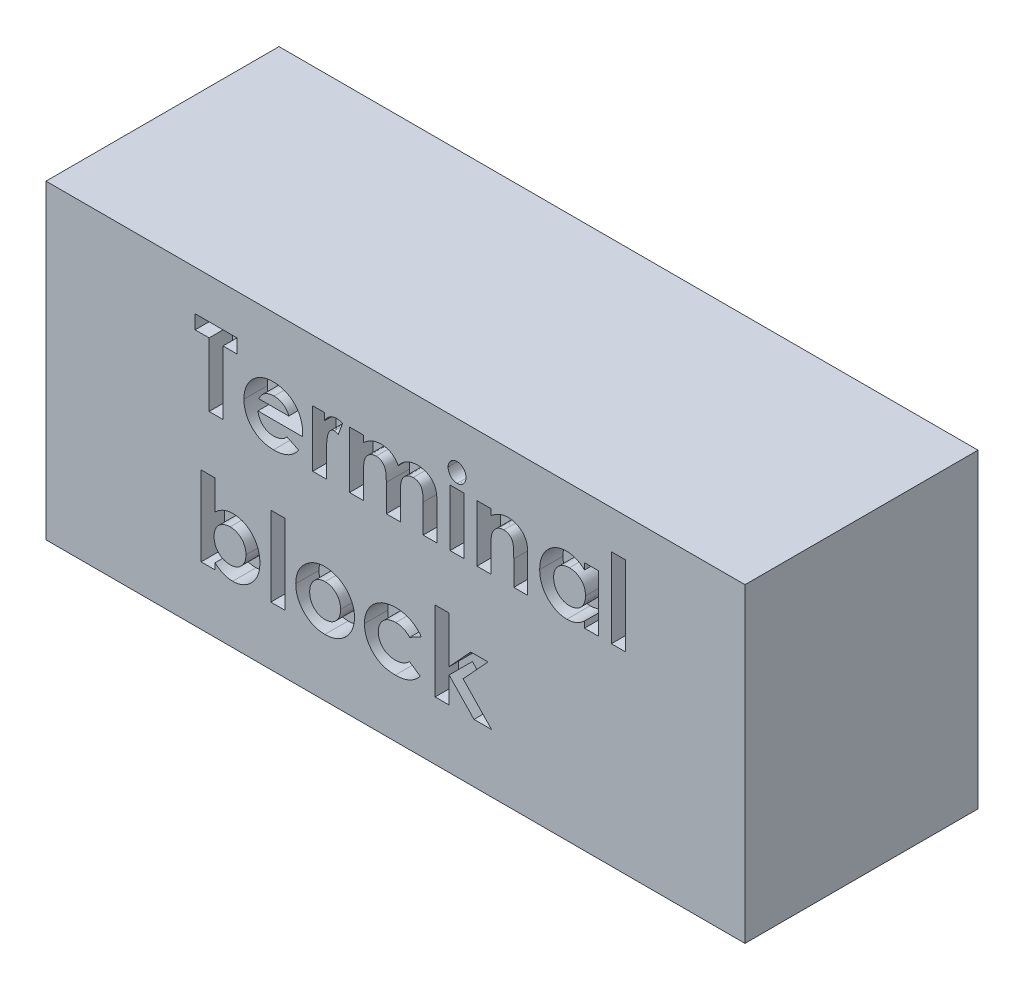
from build123d import *

# Parameters (mm, degrees)
SKETCH_1_W          = 90
SKETCH_1_H          = 40
EXTRUDE_1_DEPTH     = 30
SKETCH_2_W          = 1.794871795
SKETCH_2_H          = 7.307692308
SKETCH_2_H_2        = 10.256410257
CUT_EXTRUDE_1_DEPTH = 3


with BuildPart() as part:
    # ｽｹｯﾁ1 → ﾎﾞｽ - 押し出し1 (new body)
    with BuildSketch(Plane.XY):
        with Locations((45, 20)):
            Rectangle(SKETCH_1_W, SKETCH_1_H)
    extrude(amount=EXTRUDE_1_DEPTH)

    # ｽｹｯﾁ2 → ｶｯﾄ - 押し出し1 (cut)
    # profile 1 of 14: a face of its own
    with BuildSketch(Plane.XY.offset(30)):
        Polygon((19.206870216, 34.815425853), (24.591485601, 34.815425853), (24.591485601, 33.020554058), (22.796613806, 33.020554058), (22.796613806, 24.815425853), (21.001742011, 24.815425853), (21.001742011, 33.020554058), (19.206870216, 33.020554058), align=None)
    # profile 2 of 14: a face of its own
    with BuildSketch(Plane.XY.offset(30)):
        with BuildLine():
            Line((33.047014447, 28.020554058), (27.283793293, 28.020554058))
            add(Edge.make_bspline(
                [(27.283793293, 28.020554058), (27.295544036, 27.953588698), (27.318635172, 27.821996482), (27.368778395, 27.63084737), (27.432768668, 27.450711672), (27.509456981, 27.281348593), (27.597550368, 27.121862776), (27.700304007, 26.973002271), (27.81641456, 26.834898562), (27.945210707, 26.708151863), (28.08454565, 26.594584073), (28.233743666, 26.495091511), (28.392958719, 26.413513695), (28.560365467, 26.344752062), (28.737214825, 26.290285883), (28.923767069, 26.252721595), (29.119527679, 26.230532232), (29.252885787, 26.227322794), (29.321052909, 26.225682263)],
                knots=[0, 0, 0, 0, 1.091296461, 2.144483647, 3.168565212, 4.157007626, 5.126487748, 6.090021542, 7.05641414, 8.019231907, 8.98705074, 9.938580405, 10.892824166, 11.854447369, 12.841318655, 13.858982407, 14.905600794, 16, 16, 16, 16], degree=3))
            add(Edge.make_bspline(
                [(29.321052909, 26.225682263), (29.403335252, 26.227854597), (29.565373418, 26.232132561), (29.802760538, 26.270071749), (30.032348463, 26.327377225), (30.251964482, 26.412595277), (30.464152501, 26.518676773), (30.665419254, 26.650841262), (30.859248512, 26.805226469), (30.977507201, 26.924226528), (31.037799703, 26.984897007)],
                knots=[0, 0, 0, 0, 1.021034703, 2.010718019, 2.977989445, 3.954245119, 4.929443971, 5.918328161, 6.938689359, 8, 8, 8, 8], degree=3))
            Line((31.037799703, 26.984897007), (32.54020355, 26.269752776))
            add(Edge.make_bspline(
                [(32.54020355, 26.269752776), (32.492901241, 26.204388246), (32.399173457, 26.074870833), (32.246165995, 25.892606383), (32.086492965, 25.722546257), (31.920035283, 25.565808966), (31.746581841, 25.42284115), (31.566615142, 25.291901203), (31.377505048, 25.176504809), (31.183032781, 25.07106916), (30.979178238, 24.980679668), (30.766505576, 24.903598699), (30.545915582, 24.833918159), (30.314622683, 24.780825405), (30.07455285, 24.738797614), (29.825131791, 24.708952315), (29.566392378, 24.690518303), (29.390528707, 24.688332974), (29.301020857, 24.687220725)],
                knots=[0, 0, 0, 0, 1.028154879, 2.037251081, 3.030720504, 4.000128189, 4.949298328, 5.894184978, 6.834267904, 7.770992897, 8.712077017, 9.673380525, 10.653304757, 11.658697181, 12.695551717, 13.758623199, 14.859225354, 16, 16, 16, 16], degree=3))
            add(Edge.make_bspline(
                [(29.301020857, 24.687220725), (29.1633145, 24.690028143), (28.893624537, 24.69552631), (28.499154213, 24.746557169), (28.124516816, 24.831171832), (27.7686545, 24.946192472), (27.43310554, 25.09805575), (27.11770387, 25.283797136), (26.819298178, 25.499855597), (26.547006424, 25.750765624), (26.298940602, 26.023866272), (26.081055007, 26.317157719), (25.898731445, 26.628590847), (25.749003668, 26.956104529), (25.632630039, 27.30053707), (25.548731403, 27.662038774), (25.497300533, 28.04043698), (25.491745744, 28.298168399), (25.488921498, 28.429207904)],
                knots=[0, 0, 0, 0, 1.103565453, 2.161269334, 3.182010356, 4.179077853, 5.15417608, 6.128274628, 7.109042802, 8.101804412, 9.090965879, 10.063106201, 11.02526161, 11.978650795, 12.945248442, 13.93468508, 14.949922959, 16, 16, 16, 16], degree=3))
            add(Edge.make_bspline(
                [(25.488921498, 28.429207904), (25.49177354, 28.563577292), (25.497384805, 28.827943027), (25.548288583, 29.215078621), (25.63286199, 29.584458341), (25.749576038, 29.93659086), (25.897032425, 30.272577498), (26.081675742, 30.589478776), (26.298832477, 30.88839797), (26.546004647, 31.167936707), (26.819449913, 31.420250957), (27.110011343, 31.645113377), (27.420953693, 31.832483671), (27.748759935, 31.983878752), (28.091333304, 32.106883434), (28.452633469, 32.188732777), (28.829911485, 32.243689712), (29.08781043, 32.248750902), (29.218889447, 32.251323289)],
                knots=[0, 0, 0, 0, 1.079208495, 2.12329425, 3.130605359, 4.119693003, 5.099659317, 6.073216462, 7.060498243, 8.06384408, 9.066070512, 10.045757761, 11.010926815, 11.975797609, 12.942977511, 13.929384301, 14.947594487, 16, 16, 16, 16], degree=3))
            add(Edge.make_bspline(
                [(29.218889447, 32.251323289), (29.357255511, 32.248472316), (29.628923017, 32.242874723), (30.026140705, 32.192258224), (30.40326565, 32.10712759), (30.761904614, 31.993101513), (31.097477631, 31.837402009), (31.417358258, 31.656231424), (31.713873943, 31.435502695), (31.990185228, 31.185820541), (32.239612634, 30.908806844), (32.457639823, 30.607885125), (32.643154127, 30.285992205), (32.793515311, 29.941822738), (32.909769446, 29.576409956), (32.993745746, 29.190228418), (33.04478432, 28.781809275), (33.050235748, 28.50214128), (33.053024062, 28.359095725)],
                knots=[0, 0, 0, 0, 1.080001299, 2.120471247, 3.119684163, 4.095710327, 5.052285597, 6.002875087, 6.961153713, 7.931888285, 8.906493152, 9.865905668, 10.82813294, 11.801621613, 12.7925306, 13.817193356, 14.883530496, 16, 16, 16, 16], degree=3))
            Line((33.053024062, 28.359095725), (33.047014447, 28.020554058))
        make_face()
        with BuildLine():
            add(Edge.make_bspline(
                [(31.258152267, 29.430810469), (31.224281939, 29.522212765), (31.156938903, 29.703944341), (31.004813786, 29.954689573), (30.802948624, 30.171845127), (30.568164958, 30.364094661), (30.299909919, 30.520136392), (30.006636693, 30.633115673), (29.692052196, 30.700859467), (29.475635014, 30.708804624), (29.365123421, 30.712861751)],
                knots=[0, 0, 0, 0, 0.954238005, 1.897273737, 2.851915805, 3.847685534, 4.862635127, 5.880135777, 6.917509367, 8, 8, 8, 8], degree=3))
            add(Edge.make_bspline(
                [(29.365123421, 30.712861751), (29.244426769, 30.708964386), (29.008489945, 30.701345851), (28.66816714, 30.620319928), (28.347149154, 30.499391158), (28.157895143, 30.374711029), (28.063040088, 30.312220725)],
                knots=[0, 0, 0, 0, 1.044195649, 2.041185066, 3.018232172, 4, 4, 4, 4], degree=3))
            add(Edge.make_bspline(
                [(28.063040088, 30.312220725), (28.003857618, 30.264626741), (27.877683617, 30.1631588), (27.713821079, 29.960739892), (27.552415115, 29.715656033), (27.460646925, 29.529497528), (27.411998421, 29.430810469)],
                knots=[0, 0, 0, 0, 0.82159062, 1.751589201, 2.808063854, 4, 4, 4, 4], degree=3))
            Line((27.411998421, 29.430810469), (31.258152267, 29.430810469))
        make_face(mode=Mode.SUBTRACT)
    # profile 3 of 14: a face of its own
    with BuildSketch(Plane.XY.offset(30)):
        with BuildLine():
            Line((34.335075344, 32.123118161), (35.873536883, 32.123118161))
            Line((35.873536883, 32.123118161), (35.873536883, 31.223679058))
            add(Edge.make_bspline(
                [(35.873536883, 31.223679058), (35.917057006, 31.303612459), (36.002118893, 31.459845606), (36.158384713, 31.669557667), (36.337909217, 31.846171314), (36.534241533, 31.993380582), (36.747976706, 32.108115752), (36.97339129, 32.189879024), (37.208556866, 32.243013822), (37.36897885, 32.248533522), (37.450059319, 32.251323289)],
                knots=[0, 0, 0, 0, 1.09866127, 2.147379032, 3.14564304, 4.131443017, 5.102343063, 6.064490016, 7.021754664, 8, 8, 8, 8], degree=3))
            add(Edge.make_bspline(
                [(37.450059319, 32.251323289), (37.508933857, 32.248566417), (37.628823438, 32.24295244), (37.811552032, 32.210318308), (37.996917078, 32.151309593), (38.118903251, 32.098180087), (38.181229191, 32.071034828)],
                knots=[0, 0, 0, 0, 0.931404136, 1.896671404, 2.925354185, 4, 4, 4, 4], degree=3))
            Line((38.181229191, 32.071034828), (37.624338165, 30.550602135))
            add(Edge.make_bspline(
                [(37.624338165, 30.550602135), (37.57456006, 30.574652509), (37.480996384, 30.619857953), (37.345158173, 30.673205035), (37.221879364, 30.705754817), (37.143722862, 30.710611529), (37.107511242, 30.712861751)],
                knots=[0, 0, 0, 0, 1.214386998, 2.282580073, 3.20428172, 4, 4, 4, 4], degree=3))
            add(Edge.make_bspline(
                [(37.107511242, 30.712861751), (37.073320431, 30.711370635), (37.006061214, 30.708437354), (36.906788493, 30.68330013), (36.813294262, 30.639951765), (36.721073039, 30.584418209), (36.637400056, 30.507222412), (36.553778756, 30.417854571), (36.480087189, 30.307518083), (36.402321215, 30.18470797), (36.336106269, 30.034388501), (36.279328991, 29.854938033), (36.228739981, 29.644280199), (36.193927835, 29.401296511), (36.160280498, 29.128338254), (36.140252777, 28.82340195), (36.125325863, 28.487451835), (36.124413182, 28.25294653), (36.123937524, 28.13073034)],
                knots=[0, 0, 0, 0, 0.544232178, 1.070598461, 1.618251235, 2.182094276, 2.777567932, 3.425210017, 4.127676488, 4.886675562, 5.738955394, 6.734782583, 7.883056018, 9.186093582, 10.642914445, 12.264202625, 14.053029461, 16, 16, 16, 16], degree=3))
            Line((36.123937524, 28.13073034), (36.129947139, 27.774159828))
            Line((36.129947139, 27.774159828), (36.129947139, 24.815425853))
            Line((36.129947139, 24.815425853), (34.335075344, 24.815425853))
            Line((34.335075344, 24.815425853), (34.335075344, 32.123118161))
        make_face()
    # profile 4 of 14: a face of its own
    with BuildSketch(Plane.XY.offset(30)):
        with BuildLine():
            Line((39.078665088, 32.123118161), (40.873536883, 32.123118161))
            Line((40.873536883, 32.123118161), (40.873536883, 31.249720725))
            add(Edge.make_bspline(
                [(40.873536883, 31.249720725), (40.953371868, 31.330297168), (41.110560393, 31.488945561), (41.371052528, 31.692902333), (41.642772201, 31.86731057), (41.929012224, 32.008505015), (42.229072467, 32.116317171), (42.5415308, 32.195320329), (42.867992138, 32.241929718), (43.090268186, 32.24815739), (43.203264447, 32.251323289)],
                knots=[0, 0, 0, 0, 1.041528618, 2.050684245, 3.032913108, 4.004406485, 4.976926473, 5.95771665, 6.961784757, 8, 8, 8, 8], degree=3))
            add(Edge.make_bspline(
                [(43.203264447, 32.251323289), (43.316409902, 32.247764361), (43.539133071, 32.240758725), (43.864084625, 32.176650595), (44.171924303, 32.072496546), (44.459265147, 31.924037747), (44.728183888, 31.740698847), (44.966767248, 31.513007981), (45.181520943, 31.250029028), (45.295992929, 31.051214113), (45.354706755, 30.949239956)],
                knots=[0, 0, 0, 0, 1.023965777, 2.015643508, 2.987309376, 3.958410333, 4.93654923, 5.924956801, 6.93568961, 8, 8, 8, 8], degree=3))
            add(Edge.make_bspline(
                [(45.354706755, 30.949239956), (45.430337749, 31.051491521), (45.578780168, 31.25218265), (45.841907875, 31.514207673), (46.126427431, 31.74072259), (46.437843635, 31.925391284), (46.76788635, 32.071989807), (47.115111353, 32.176263606), (47.476370584, 32.240651583), (47.722227316, 32.247736502), (47.846693934, 32.251323289)],
                knots=[0, 0, 0, 0, 1.041189987, 2.043563759, 3.033412161, 4.015238574, 5.00275396, 5.986226558, 6.980513695, 8, 8, 8, 8], degree=3))
            add(Edge.make_bspline(
                [(47.846693934, 32.251323289), (47.975253171, 32.247598963), (48.225610333, 32.240346185), (48.588413811, 32.168991543), (48.928223172, 32.058737914), (49.237528723, 31.898291901), (49.517212633, 31.708237243), (49.755537064, 31.483679735), (49.953324566, 31.232455146), (50.082109593, 30.997872679), (50.165365653, 30.790474915), (50.215636401, 30.61), (50.262655105, 30.408476931), (50.296433338, 30.183196955), (50.327963829, 29.936277529), (50.346268518, 29.666077051), (50.358710406, 29.373505761), (50.360031891, 29.171077279), (50.36071637, 29.066227135)],
                knots=[0, 0, 0, 0, 1.321991808, 2.574456155, 3.791773975, 4.987670122, 6.148905103, 7.262530793, 8.344737981, 9.427709016, 10.004683293, 10.642050061, 11.354108788, 12.133887687, 12.985666279, 13.916212488, 14.92067847, 16, 16, 16, 16], degree=3))
            Line((50.36071637, 29.066227135), (50.36071637, 24.815425853))
            Line((50.36071637, 24.815425853), (48.565844575, 24.815425853))
            Line((48.565844575, 24.815425853), (48.565844575, 28.485297648))
            add(Edge.make_bspline(
                [(48.565844575, 28.485297648), (48.564350684, 28.583459897), (48.561483296, 28.771873463), (48.549292923, 29.042116753), (48.522005654, 29.287204095), (48.490021478, 29.508493046), (48.444251505, 29.704810305), (48.388443334, 29.87662912), (48.323706195, 30.024196818), (48.24553805, 30.147498019), (48.157989636, 30.251337107), (48.060604656, 30.340347769), (47.954398496, 30.416291477), (47.838408241, 30.481022696), (47.709595244, 30.524801701), (47.572308029, 30.55915227), (47.425472282, 30.582545254), (47.323950079, 30.583939875), (47.271774062, 30.584656622)],
                knots=[0, 0, 0, 0, 1.669139205, 3.203761885, 4.596586177, 5.860166715, 7.002923539, 8.018877315, 8.928339525, 9.734594377, 10.491888885, 11.231098709, 11.971440889, 12.708030942, 13.480072485, 14.275788656, 15.113863979, 16, 16, 16, 16], degree=3))
            add(Edge.make_bspline(
                [(47.271774062, 30.584656622), (47.191371559, 30.5818769), (47.033597645, 30.576422246), (46.803688897, 30.524296928), (46.587343071, 30.439077611), (46.385370687, 30.323144278), (46.202117743, 30.178345735), (46.041817805, 30.006600858), (45.909432412, 29.806919864), (45.817792016, 29.621655956), (45.76052828, 29.454140156), (45.720133918, 29.310676327), (45.688648119, 29.148439956), (45.664003957, 28.969074123), (45.640360761, 28.771564855), (45.628761542, 28.556161909), (45.616892001, 28.323164532), (45.617046518, 28.162133369), (45.617126626, 28.078647007)],
                knots=[0, 0, 0, 0, 1.129913425, 2.217230253, 3.297175357, 4.391411011, 5.481605898, 6.571841268, 7.681894157, 8.841607612, 9.468549532, 10.170608623, 10.93710061, 11.791434153, 12.717934886, 13.734733707, 14.825576123, 16, 16, 16, 16], degree=3))
            Line((45.617126626, 28.078647007), (45.617126626, 24.815425853))
            Line((45.617126626, 24.815425853), (43.822254832, 24.815425853))
            Line((43.822254832, 24.815425853), (43.822254832, 28.319031622))
            add(Edge.make_bspline(
                [(43.822254832, 28.319031622), (43.822104134, 28.397166644), (43.82181424, 28.547473116), (43.813100604, 28.764518539), (43.801562047, 28.964930222), (43.785386334, 29.149267149), (43.766730834, 29.31730005), (43.739806649, 29.468109669), (43.711520309, 29.602527012), (43.663022995, 29.755221103), (43.594684045, 29.924431709), (43.492584654, 30.103870135), (43.369132545, 30.254107529), (43.227447964, 30.376313057), (43.067338308, 30.469423863), (42.892859652, 30.538686731), (42.700680436, 30.576072701), (42.568397113, 30.581734933), (42.500139447, 30.584656622)],
                knots=[0, 0, 0, 0, 1.256487322, 2.417074606, 3.49288742, 4.484586665, 5.393016842, 6.210437544, 6.947749329, 7.599905853, 8.784490193, 9.876739139, 10.906602197, 11.896672079, 12.869113195, 13.872201355, 14.902064413, 16, 16, 16, 16], degree=3))
            add(Edge.make_bspline(
                [(42.500139447, 30.584656622), (42.423014158, 30.582038856), (42.270266879, 30.576854349), (42.047767132, 30.521168501), (41.835036739, 30.437512798), (41.636755553, 30.31834591), (41.456263326, 30.170139816), (41.297568332, 29.9935098), (41.165878675, 29.788665374), (41.073831504, 29.598291223), (41.017402741, 29.426596136), (40.975922234, 29.279407133), (40.945607906, 29.113597952), (40.920315283, 28.931030336), (40.896812063, 28.731488785), (40.88516485, 28.514095792), (40.873307037, 28.279092319), (40.873458421, 28.116727006), (40.873536883, 28.032573289)],
                knots=[0, 0, 0, 0, 1.07893236, 2.136834559, 3.195274846, 4.273923004, 5.364443877, 6.458052972, 7.587287137, 8.767908, 9.410170275, 10.118584836, 10.909717261, 11.770069756, 12.702352573, 13.724628867, 14.820678298, 16, 16, 16, 16], degree=3))
            Line((40.873536883, 28.032573289), (40.873536883, 24.815425853))
            Line((40.873536883, 24.815425853), (39.078665088, 24.815425853))
            Line((39.078665088, 24.815425853), (39.078665088, 32.123118161))
        make_face()
    # profile 5 of 14: a face of its own
    with BuildSketch(Plane.XY.offset(30)):
        with BuildLine():
            add(Edge.make_bspline(
                [(52.920812524, 35.200041238), (52.998171486, 35.196245714), (53.15007326, 35.188792838), (53.367693223, 35.116143876), (53.567424245, 35.002123502), (53.743992007, 34.845684829), (53.890844561, 34.658868442), (54.003045367, 34.449715075), (54.065547761, 34.217979881), (54.074228419, 34.057899633), (54.078665088, 33.976082904)],
                knots=[0, 0, 0, 0, 0.989868614, 1.943702388, 2.910836514, 3.924849579, 4.949916355, 5.946401046, 6.950409252, 8, 8, 8, 8], degree=3))
            add(Edge.make_bspline(
                [(54.078665088, 33.976082904), (54.074387156, 33.89486912), (54.066051401, 33.736620195), (54.001606836, 33.508030914), (53.893909381, 33.298979133), (53.745867413, 33.114937316), (53.571213876, 32.961018181), (53.37584713, 32.844927835), (53.160312597, 32.776320318), (53.010767879, 32.768244423), (52.93483496, 32.764143802)],
                knots=[0, 0, 0, 0, 1.05296456, 2.051751585, 3.055639087, 4.085634717, 5.099016424, 6.062201612, 7.016062274, 8, 8, 8, 8], degree=3))
            add(Edge.make_bspline(
                [(52.93483496, 32.764143802), (52.856800719, 32.767925757), (52.703577405, 32.775351775), (52.48417251, 32.848170719), (52.281777587, 32.96129311), (52.105975774, 33.120928066), (51.95744143, 33.309071926), (51.850141601, 33.523094564), (51.783022903, 33.756414358), (51.775055972, 33.918865503), (51.77097278, 34.002124571)],
                knots=[0, 0, 0, 0, 0.989065327, 1.942068821, 2.907541208, 3.917690034, 4.939857478, 5.938239964, 6.943311734, 8, 8, 8, 8], degree=3))
            add(Edge.make_bspline(
                [(51.77097278, 34.002124571), (51.775416409, 34.081959297), (51.784145277, 34.23878309), (51.847022068, 34.465366131), (51.956650113, 34.671003303), (52.102444873, 34.854399842), (52.277461777, 35.007920344), (52.477072897, 35.118477846), (52.69322827, 35.188126199), (52.844167801, 35.196028549), (52.920812524, 35.200041238)],
                knots=[0, 0, 0, 0, 1.038616768, 2.040212704, 3.031499824, 4.052181184, 5.074969369, 6.039807101, 7.004644834, 8, 8, 8, 8], degree=3))
        make_face()
    # profile 6 of 14: a face of its own
    with BuildSketch(Plane.XY.offset(30)):
        with Locations((52.924818935, 28.469272007)):
            Rectangle(SKETCH_2_W, SKETCH_2_H)
    # profile 7 of 14: a face of its own
    with BuildSketch(Plane.XY.offset(30)):
        with BuildLine():
            Line((55.488921498, 32.123118161), (57.283793293, 32.123118161))
            Line((57.283793293, 32.123118161), (57.283793293, 31.349880981))
            add(Edge.make_bspline(
                [(57.283793293, 31.349880981), (57.386189839, 31.429527124), (57.581889545, 31.581746385), (57.879386885, 31.775826719), (58.160187542, 31.934673679), (58.430550861, 32.055500805), (58.695563737, 32.142430727), (58.959518243, 32.20488469), (59.226345197, 32.244875679), (59.405717677, 32.249175239), (59.495331755, 32.251323289)],
                knots=[0, 0, 0, 0, 1.276643801, 2.439914479, 3.493451431, 4.44993799, 5.350072675, 6.235028322, 7.118224225, 8, 8, 8, 8], degree=3))
            add(Edge.make_bspline(
                [(59.495331755, 32.251323289), (59.586233177, 32.248868512), (59.764680303, 32.24404958), (60.027433863, 32.21034505), (60.278469371, 32.148958424), (60.520609517, 32.067453588), (60.751389727, 31.959871878), (60.9736372, 31.832136053), (61.182578137, 31.676545176), (61.311253217, 31.558054634), (61.37634137, 31.498118161)],
                knots=[0, 0, 0, 0, 1.048836932, 2.058954983, 3.049370783, 4.026390553, 5.001981509, 5.982488534, 6.97947532, 8, 8, 8, 8], degree=3))
            add(Edge.make_bspline(
                [(61.37634137, 31.498118161), (61.428544465, 31.442574577), (61.533332718, 31.331080895), (61.665195569, 31.14028665), (61.778348728, 30.932286001), (61.871062018, 30.704679592), (61.939573405, 30.456216874), (61.992280149, 30.189898922), (62.021854823, 29.904234551), (62.025505955, 29.707985824), (62.027383037, 29.60709252)],
                knots=[0, 0, 0, 0, 0.889584746, 1.785680191, 2.700364693, 3.65222533, 4.649950538, 5.707241244, 6.821271309, 8, 8, 8, 8], degree=3))
            Line((62.027383037, 29.60709252), (62.027383037, 24.815425853))
            Line((62.027383037, 24.815425853), (60.232511242, 24.815425853))
            Line((60.232511242, 24.815425853), (60.232511242, 27.988502776))
            add(Edge.make_bspline(
                [(60.232511242, 27.988502776), (60.232131666, 28.092003018), (60.23140428, 28.29034202), (60.225819561, 28.57419494), (60.214914937, 28.830550988), (60.204975656, 29.059876916), (60.185460896, 29.261358462), (60.167862171, 29.436271158), (60.140858633, 29.583028182), (60.105722649, 29.740887382), (60.044366567, 29.909904523), (59.949114242, 30.087992004), (59.82827331, 30.239281289), (59.686779398, 30.364832992), (59.524788773, 30.464155904), (59.344258858, 30.53403576), (59.146157508, 30.577586602), (59.008122815, 30.582239988), (58.936437524, 30.584656622)],
                knots=[0, 0, 0, 0, 1.49886392, 2.872294502, 4.110984203, 5.214877267, 6.195405875, 7.042225351, 7.75923308, 8.355011229, 9.382752534, 10.352059385, 11.267231453, 12.171456522, 13.078624015, 14.003401117, 14.963110155, 16, 16, 16, 16], degree=3))
            add(Edge.make_bspline(
                [(58.936437524, 30.584656622), (58.843207788, 30.579928918), (58.660832301, 30.570680608), (58.397062643, 30.500939915), (58.154794608, 30.382331525), (57.936007723, 30.218201363), (57.742785752, 30.015562341), (57.58364301, 29.773892061), (57.453113268, 29.499023222), (57.396983539, 29.298324322), (57.367927909, 29.194432263)],
                knots=[0, 0, 0, 0, 0.984188326, 1.925263693, 2.85911992, 3.81709677, 4.80007086, 5.801799564, 6.862098548, 8, 8, 8, 8], degree=3))
            add(Edge.make_bspline(
                [(57.367927909, 29.194432263), (57.36070643, 29.161804266), (57.344601081, 29.089037272), (57.331356469, 28.96610539), (57.312932252, 28.820258614), (57.30602915, 28.648857527), (57.294025417, 28.452713301), (57.289585863, 28.231566441), (57.285138365, 27.985850579), (57.284256504, 27.814227385), (57.283793293, 27.724079699)],
                knots=[0, 0, 0, 0, 0.543362196, 1.211806945, 2.009705693, 2.934833164, 4.000995085, 5.207458376, 6.533175157, 8, 8, 8, 8], degree=3))
            Line((57.283793293, 27.724079699), (57.283793293, 24.815425853))
            Line((57.283793293, 24.815425853), (55.488921498, 24.815425853))
            Line((55.488921498, 24.815425853), (55.488921498, 32.123118161))
        make_face()
    # profile 8 of 14: a face of its own
    with BuildSketch(Plane.XY.offset(30)):
        with BuildLine():
            Line((69.335075344, 32.123118161), (71.129947139, 32.123118161))
            Line((71.129947139, 32.123118161), (71.129947139, 24.815425853))
            Line((71.129947139, 24.815425853), (69.335075344, 24.815425853))
            Line((69.335075344, 24.815425853), (69.335075344, 25.612701494))
            add(Edge.make_bspline(
                [(69.335075344, 25.612701494), (69.246140108, 25.535095535), (69.073534378, 25.384477693), (68.801563599, 25.189047213), (68.52879809, 25.027842325), (68.253927205, 24.899451423), (67.972726294, 24.804647957), (67.683170823, 24.736008032), (67.381090885, 24.69552939), (67.175741105, 24.690019129), (67.07145355, 24.687220725)],
                knots=[0, 0, 0, 0, 1.129196829, 2.191548051, 3.199897424, 4.157751732, 5.089409408, 6.034969131, 7.002052659, 8, 8, 8, 8], degree=3))
            add(Edge.make_bspline(
                [(67.07145355, 24.687220725), (66.954386132, 24.689854376), (66.72305428, 24.695058619), (66.38360047, 24.749841675), (66.055824068, 24.833699352), (65.739991139, 24.952368446), (65.436676312, 25.106140329), (65.143558307, 25.291002875), (64.865662062, 25.513445867), (64.600674185, 25.763844763), (64.358052875, 26.039285331), (64.145951034, 26.335944492), (63.967164946, 26.649614791), (63.820695071, 26.979256268), (63.7054776, 27.324626984), (63.62334403, 27.68682235), (63.574885129, 28.065971724), (63.568887282, 28.324233428), (63.565844575, 28.455249571)],
                knots=[0, 0, 0, 0, 0.980476535, 1.937477201, 2.874147792, 3.812856188, 4.758993464, 5.720109578, 6.712210464, 7.737600662, 8.772720504, 9.783789959, 10.789002326, 11.793715968, 12.802552247, 13.835794126, 14.902098527, 16, 16, 16, 16], degree=3))
            add(Edge.make_bspline(
                [(63.565844575, 28.455249571), (63.569037908, 28.590916959), (63.575301985, 28.857043658), (63.621123337, 29.247571935), (63.701741234, 29.618747905), (63.811669531, 29.9710857), (63.953073197, 30.304646193), (64.125293415, 30.61997586), (64.330673078, 30.916250481), (64.567336732, 31.188427253), (64.82287535, 31.437890412), (65.096256497, 31.655067874), (65.383205088, 31.839570234), (65.684026058, 31.990195759), (65.998676446, 32.106591542), (66.325914018, 32.191686364), (66.667191479, 32.242746245), (66.899672452, 32.248440531), (67.017367011, 32.251323289)],
                knots=[0, 0, 0, 0, 1.136281865, 2.228943489, 3.287578264, 4.313574083, 5.316051562, 6.317280042, 7.318008486, 8.329309503, 9.333984563, 10.305318864, 11.248632312, 12.186624717, 13.117503092, 14.05354244, 15.014596925, 16, 16, 16, 16], degree=3))
            add(Edge.make_bspline(
                [(67.017367011, 32.251323289), (67.126390309, 32.249058307), (67.342108117, 32.244576725), (67.659182214, 32.195915314), (67.966698356, 32.122318386), (68.262979029, 32.017456012), (68.550454423, 31.88504593), (68.824179782, 31.719126229), (69.090143093, 31.526670438), (69.252422531, 31.376358389), (69.335075344, 31.299800853)],
                knots=[0, 0, 0, 0, 1.017011718, 2.012299608, 2.98747302, 3.965332399, 4.941441765, 5.936729654, 6.94912688, 8, 8, 8, 8], degree=3))
            Line((69.335075344, 31.299800853), (69.335075344, 32.123118161))
        make_face()
        with BuildLine():
            add(Edge.make_bspline(
                [(67.393969575, 30.584656622), (67.322449225, 30.582462131), (67.182274009, 30.578161072), (66.97612717, 30.552289899), (66.779112634, 30.506703739), (66.592635492, 30.439359978), (66.413916551, 30.357325465), (66.245669684, 30.254578587), (66.0865063, 30.133133961), (65.937362456, 29.995931759), (65.801395867, 29.845121453), (65.684184732, 29.680554735), (65.584574203, 29.506665742), (65.500329584, 29.322931649), (65.44002955, 29.127178315), (65.392271949, 28.921954099), (65.367488845, 28.705582426), (65.36299645, 28.558131827), (65.36071637, 28.483294443)],
                knots=[0, 0, 0, 0, 1.04836806, 2.054732945, 3.03993516, 4.00574415, 4.955904794, 5.917688631, 6.888591924, 7.88601754, 8.884115178, 9.859153345, 10.841239365, 11.818093293, 12.814750328, 13.83810466, 14.90274714, 16, 16, 16, 16], degree=3))
            add(Edge.make_bspline(
                [(65.36071637, 28.483294443), (65.362961621, 28.407778241), (65.367385862, 28.25897444), (65.392672667, 28.040777593), (65.438711753, 27.832555534), (65.505881044, 27.635991596), (65.587910328, 27.448433481), (65.687758414, 27.270746786), (65.8104043, 27.106073237), (65.946490078, 26.950516103), (66.098693585, 26.811609619), (66.25875758, 26.688273415), (66.428868409, 26.585078091), (66.607180492, 26.501674978), (66.793093622, 26.433708452), (66.988938584, 26.388695217), (67.192796832, 26.359919108), (67.331772383, 26.355911847), (67.401982396, 26.353887392)],
                knots=[0, 0, 0, 0, 1.099136573, 2.165835871, 3.191374663, 4.196217796, 5.183857741, 6.167377911, 7.154730987, 8.166690795, 9.170734848, 10.148332609, 11.103258353, 12.059567475, 13.009337315, 13.978056681, 14.978520572, 16, 16, 16, 16], degree=3))
            add(Edge.make_bspline(
                [(67.401982396, 26.353887392), (67.474834896, 26.356094186), (67.6176654, 26.360420702), (67.82717542, 26.386055772), (68.026836568, 26.431809077), (68.215818147, 26.499538397), (68.39700667, 26.580984065), (68.568767074, 26.68172319), (68.729235499, 26.802889134), (68.879224645, 26.941331648), (69.016660783, 27.09337341), (69.135492855, 27.26009816), (69.238999938, 27.436173581), (69.320403496, 27.62576274), (69.385049337, 27.82554871), (69.431431237, 28.036771406), (69.456660301, 28.259658552), (69.461045848, 28.411787715), (69.463280473, 28.489304058)],
                knots=[0, 0, 0, 0, 1.050008698, 2.058587853, 3.036635738, 3.995319155, 4.947022481, 5.895997462, 6.858296291, 7.838991643, 8.833936038, 9.806048392, 10.784806122, 11.771666913, 12.772873988, 13.80724452, 14.882696879, 16, 16, 16, 16], degree=3))
            add(Edge.make_bspline(
                [(69.463280473, 28.489304058), (69.461073616, 28.565487158), (69.456762982, 28.714294882), (69.431322431, 28.932528249), (69.384611246, 29.139603496), (69.321295923, 29.335901254), (69.238444171, 29.52097269), (69.134858771, 29.692765803), (69.017330219, 29.857232582), (68.878372464, 30.005166854), (68.729195843, 30.142606938), (68.56636747, 30.260108735), (68.395017321, 30.361375045), (68.214092618, 30.444518591), (68.02191808, 30.505465962), (67.821915725, 30.552655282), (67.610965099, 30.578145544), (67.46748179, 30.582450845), (67.393969575, 30.584656622)],
                knots=[0, 0, 0, 0, 1.106611376, 2.161533483, 3.185006901, 4.184773755, 5.152708835, 6.122342771, 7.094156588, 8.082475533, 9.064254463, 10.03606828, 10.992420271, 11.951521816, 12.920622147, 13.915721683, 14.932141191, 16, 16, 16, 16], degree=3))
        make_face(mode=Mode.SUBTRACT)
    # profile 9 of 14: a face of its own
    with BuildSketch(Plane.XY.offset(30)):
        with Locations((73.694049704, 29.943630982)):
            Rectangle(SKETCH_2_W, SKETCH_2_H_2)
    # profile 10 of 14: a face of its own
    with BuildSketch(Plane.XY.offset(30)):
        with BuildLine():
            Line((21.77097278, 17.789784828), (21.77097278, 13.989704699))
            add(Edge.make_bspline(
                [(21.77097278, 13.989704699), (21.854318418, 14.06817964), (22.017930342, 14.222230128), (22.285062691, 14.421434269), (22.561779988, 14.589560932), (22.847834335, 14.730611337), (23.145800246, 14.83491203), (23.452016672, 14.915957575), (23.769621325, 14.958881005), (23.98440393, 14.965789207), (24.092687524, 14.969272007)],
                knots=[0, 0, 0, 0, 1.061187343, 2.083167259, 3.083809127, 4.061667593, 5.035358583, 6.007314429, 6.995378812, 8, 8, 8, 8], degree=3))
            add(Edge.make_bspline(
                [(24.092687524, 14.969272007), (24.210393259, 14.966452658), (24.442235363, 14.960899455), (24.783346907, 14.909052329), (25.11024073, 14.825245016), (25.424163363, 14.708227166), (25.723442261, 14.556299031), (26.011440037, 14.374393776), (26.28318983, 14.15500499), (26.538823746, 13.906510406), (26.775291487, 13.634141881), (26.980974873, 13.338019489), (27.152301151, 13.022040767), (27.29750859, 12.689941244), (27.403486811, 12.336213161), (27.485165981, 11.965601541), (27.530682199, 11.574970932), (27.536988627, 11.308858437), (27.54020355, 11.173198289)],
                knots=[0, 0, 0, 0, 0.985987466, 1.942075377, 2.884088208, 3.810275091, 4.743821533, 5.692411115, 6.659945104, 7.665215984, 8.677116751, 9.678438675, 10.680260931, 11.685531812, 12.710472044, 13.769734641, 14.863044265, 16, 16, 16, 16], degree=3))
            add(Edge.make_bspline(
                [(27.54020355, 11.173198289), (27.53716084, 11.04218215), (27.531162988, 10.783920452), (27.482704126, 10.404771028), (27.400570413, 10.042575846), (27.285353459, 9.697204464), (27.138881669, 9.36756545), (26.96010274, 9.053885943), (26.747973815, 8.757261618), (26.505455713, 8.481688304), (26.240469444, 8.232136183), (25.964372745, 8.008238314), (25.671666678, 7.824771569), (25.369668242, 7.669819847), (25.053619814, 7.551331263), (24.725680146, 7.468316693), (24.386368613, 7.412816303), (24.155678099, 7.407743784), (24.038600985, 7.405169443)],
                knots=[0, 0, 0, 0, 1.098553145, 2.165490463, 3.199345634, 4.208780719, 5.21409072, 6.219899742, 7.23156933, 8.267303578, 9.293302409, 10.281606823, 11.243293419, 12.184993323, 13.124258899, 14.066907486, 15.018941492, 16, 16, 16, 16], degree=3))
            add(Edge.make_bspline(
                [(24.038600985, 7.405169443), (23.934311606, 7.407957373), (23.728958235, 7.413447011), (23.42625882, 7.454162389), (23.135375673, 7.522637809), (22.852634246, 7.616963142), (22.577267372, 7.74583928), (22.30447953, 7.906982031), (22.032515117, 8.102430222), (21.859908482, 8.253045549), (21.77097278, 8.330650212)],
                knots=[0, 0, 0, 0, 0.996418773, 1.962021009, 2.912343664, 3.848616743, 4.805003894, 5.811808768, 6.872532775, 8, 8, 8, 8], degree=3))
            Line((21.77097278, 8.330650212), (21.77097278, 7.533374571))
            Line((21.77097278, 7.533374571), (19.976100985, 7.533374571))
            Line((19.976100985, 7.533374571), (19.976100985, 17.789784828))
            Line((19.976100985, 17.789784828), (21.77097278, 17.789784828))
        make_face()
        with BuildLine():
            add(Edge.make_bspline(
                [(23.704065729, 13.30260534), (23.631224477, 13.300365422), (23.488416025, 13.295973964), (23.278747207, 13.270806537), (23.080082311, 13.223453839), (22.889400797, 13.162079895), (22.709117242, 13.079234709), (22.537756722, 12.978809314), (22.376786958, 12.859059697), (22.225372518, 12.724727794), (22.089314605, 12.57360415), (21.968438953, 12.412120699), (21.868156498, 12.238174621), (21.784560141, 12.053971533), (21.721490343, 11.857518375), (21.674710825, 11.650486378), (21.649289122, 11.432241081), (21.644975857, 11.283435023), (21.642767652, 11.207252776)],
                knots=[0, 0, 0, 0, 1.060469436, 2.079096586, 3.066888298, 4.028858836, 4.99004353, 5.948472697, 6.914558426, 7.905691313, 8.889602648, 9.869280844, 10.836099585, 11.806137001, 12.808075328, 13.83377171, 14.890985086, 16, 16, 16, 16], degree=3))
            add(Edge.make_bspline(
                [(21.642767652, 11.207252776), (21.645003643, 11.129737278), (21.64939187, 10.977609776), (21.674601651, 10.75471069), (21.721052824, 10.543530886), (21.785450991, 10.343591564), (21.867624843, 10.154866785), (21.967788483, 9.976656917), (22.089994663, 9.81286912), (22.224557929, 9.657760998), (22.376908602, 9.521631705), (22.537153194, 9.399542456), (22.70907561, 9.298967365), (22.890220747, 9.217477769), (23.07921409, 9.14976036), (23.278872, 9.104003777), (23.488382911, 9.078369609), (23.631213292, 9.074042968), (23.704065729, 9.07183611)],
                knots=[0, 0, 0, 0, 1.117193555, 2.192540452, 3.22680955, 4.227918444, 5.21468246, 6.188555072, 7.166222992, 8.154674427, 9.142376254, 10.104580718, 11.053462639, 12.005072638, 12.963662044, 13.941614018, 14.950094269, 16, 16, 16, 16], degree=3))
            add(Edge.make_bspline(
                [(23.704065729, 9.07183611), (23.774268181, 9.073886213), (23.913228767, 9.077944243), (24.116551645, 9.106259745), (24.311995586, 9.152530092), (24.498030005, 9.218482073), (24.675787368, 9.304351486), (24.846885924, 9.404832912), (25.00541871, 9.530376951), (25.157605231, 9.668360569), (25.293771509, 9.823966404), (25.415929025, 9.98927711), (25.518544969, 10.165768117), (25.60001961, 10.354024696), (25.667377018, 10.550480995), (25.713364046, 10.758732841), (25.738665266, 10.97692144), (25.743087515, 11.12572638), (25.745331755, 11.201243161)],
                knots=[0, 0, 0, 0, 1.021711385, 2.02240246, 2.981887075, 3.941027022, 4.888772411, 5.852236371, 6.822344989, 7.82661704, 8.838806642, 9.826383926, 10.814965113, 11.80282933, 12.807900643, 13.833672313, 14.900613836, 16, 16, 16, 16], degree=3))
            add(Edge.make_bspline(
                [(25.745331755, 11.201243161), (25.743051675, 11.276080545), (25.73855928, 11.423531144), (25.713776175, 11.639902816), (25.666018577, 11.845127039), (25.60571853, 12.040880346), (25.52147396, 12.224614538), (25.42186325, 12.398503161), (25.304652794, 12.563071261), (25.168683615, 12.713876303), (25.019549391, 12.851098057), (24.860351147, 12.97247183), (24.691714068, 13.075795493), (24.511341688, 13.157277905), (24.323490509, 13.224320369), (24.125289775, 13.270500105), (23.917747118, 13.296058554), (23.776249501, 13.300393769), (23.704065729, 13.30260534)],
                knots=[0, 0, 0, 0, 1.094680664, 2.156827393, 3.177782763, 4.17210342, 5.146667393, 6.126451192, 7.099203661, 8.094961544, 9.09004898, 10.058676268, 11.018205477, 11.974998356, 12.947750825, 13.930643515, 14.944335875, 16, 16, 16, 16], degree=3))
        make_face(mode=Mode.SUBTRACT)
    # profile 11 of 14: a face of its own
    with BuildSketch(Plane.XY.offset(30)):
        with Locations((29.847895858, 12.6615797)):
            Rectangle(SKETCH_2_W, SKETCH_2_H_2)
    # profile 12 of 14: a face of its own
    with BuildSketch(Plane.XY.offset(30)):
        with BuildLine():
            add(Edge.make_bspline(
                [(35.893568934, 14.969272007), (35.978427008, 14.9677619), (36.146484444, 14.964771202), (36.396785001, 14.93987638), (36.642709727, 14.899259452), (36.885672165, 14.846667619), (37.123416182, 14.772978595), (37.357188715, 14.684600005), (37.589079988, 14.583131049), (37.813334507, 14.462347499), (38.031572343, 14.331346724), (38.238474799, 14.18684212), (38.432323694, 14.029968722), (38.616717523, 13.864363764), (38.783063235, 13.682817345), (38.941991215, 13.494077134), (39.08491497, 13.291381227), (39.217241779, 13.079668855), (39.335051386, 12.860164309), (39.437347363, 12.634394541), (39.526130653, 12.405480977), (39.59564619, 12.170635294), (39.653198647, 11.932954244), (39.689518338, 11.689525224), (39.71533912, 11.44284886), (39.718234448, 11.276766034), (39.719690729, 11.19323034)],
                knots=[0, 0, 0, 0, 1.022364134, 2.024744242, 3.027414945, 4.024939316, 5.017584196, 6.023349371, 7.035562955, 8.064994934, 9.090267829, 10.101425541, 11.102933353, 12.093946398, 13.084502048, 14.067315274, 15.065326281, 16.070028806, 17.074376865, 18.064572984, 19.055292013, 20.030201733, 21.013838017, 21.999348303, 22.993720005, 24, 24, 24, 24], degree=3))
            add(Edge.make_bspline(
                [(39.719690729, 11.19323034), (39.718153866, 11.109042025), (39.715098234, 10.941656568), (39.690452502, 10.692659908), (39.649680105, 10.448086155), (39.596886422, 10.206494482), (39.523473164, 9.970976284), (39.437697607, 9.738059932), (39.332404737, 9.510920163), (39.21599571, 9.287079095), (39.082818095, 9.073123688), (38.940018057, 8.868397257), (38.781755746, 8.678270739), (38.616741677, 8.49684778), (38.43714886, 8.330263295), (38.245843931, 8.175812394), (38.04448306, 8.031606846), (37.83161825, 7.901029986), (37.609975943, 7.786296756), (37.383294095, 7.682855386), (37.150247198, 7.596733059), (36.911317553, 7.526502673), (36.666360259, 7.472125043), (36.415916118, 7.435185672), (36.160524493, 7.409494766), (35.988451673, 7.406620499), (35.901581755, 7.405169443)],
                knots=[0, 0, 0, 0, 1.012026251, 2.012137606, 3.004615893, 3.992048833, 4.982446996, 5.968083444, 6.973977695, 7.990229942, 8.999482246, 10.001782172, 10.988562221, 11.971415814, 12.948383116, 13.930088534, 14.925840678, 15.924049238, 16.929462851, 17.924729459, 18.917889337, 19.913673841, 20.916777188, 21.931792057, 22.95587778, 24, 24, 24, 24], degree=3))
            add(Edge.make_bspline(
                [(35.901581755, 7.405169443), (35.77456022, 7.408897775), (35.524198842, 7.416246376), (35.155475723, 7.466582364), (34.801254523, 7.553223797), (34.460958043, 7.674000045), (34.13414423, 7.828770306), (33.823665254, 8.020322006), (33.526432693, 8.244884042), (33.247594842, 8.500558396), (32.992141595, 8.781056315), (32.76897245, 9.080486134), (32.579483786, 9.394359903), (32.423846086, 9.723035545), (32.303725519, 10.066963763), (32.216977974, 10.425116331), (32.166580444, 10.798499965), (32.159293996, 11.052187576), (32.155588165, 11.18121111)],
                knots=[0, 0, 0, 0, 1.029999031, 2.030143771, 3.011211297, 3.982305373, 4.953580601, 5.938004764, 6.935448627, 7.970290061, 9.001484052, 10.007591832, 10.993831261, 11.969999897, 12.951306496, 13.942897864, 14.953773953, 16, 16, 16, 16], degree=3))
            add(Edge.make_bspline(
                [(32.155588165, 11.18121111), (32.159423229, 11.31897996), (32.166960971, 11.589761877), (32.226813956, 11.986463557), (32.322392717, 12.366286615), (32.459590008, 12.728168565), (32.63484748, 13.07277685), (32.848797134, 13.399384654), (33.102496324, 13.708065955), (33.296779102, 13.894766989), (33.395572139, 13.989704699)],
                knots=[0, 0, 0, 0, 1.043912699, 2.05178951, 3.033892, 4.007821512, 4.978932272, 5.95884105, 6.962068106, 8, 8, 8, 8], degree=3))
            add(Edge.make_bspline(
                [(33.395572139, 13.989704699), (33.486224626, 14.068397383), (33.665063216, 14.223641756), (33.955617064, 14.420543793), (34.253111419, 14.590607081), (34.561111877, 14.730430734), (34.880477065, 14.835855513), (35.209570417, 14.912595319), (35.548323503, 14.959731157), (35.777902292, 14.966075562), (35.893568934, 14.969272007)],
                knots=[0, 0, 0, 0, 1.048115528, 2.067714963, 3.060638214, 4.039924844, 5.017819947, 5.994373833, 6.98952318, 8, 8, 8, 8], degree=3))
        make_face()
        with BuildLine():
            add(Edge.make_bspline(
                [(35.933633037, 13.30260534), (35.864140526, 13.30029564), (35.727343772, 13.295748968), (35.525975355, 13.271348199), (35.335518985, 13.221336728), (35.152191845, 13.157735823), (34.979237009, 13.072678574), (34.81191786, 12.973141991), (34.658934626, 12.848584206), (34.51288396, 12.711953429), (34.380302509, 12.560228617), (34.267330523, 12.394924548), (34.166387552, 12.222365409), (34.089847615, 12.036233595), (34.0265035, 11.841616629), (33.983632963, 11.635370093), (33.953798063, 11.419797872), (33.951583244, 11.272129423), (33.95045996, 11.197236751)],
                knots=[0, 0, 0, 0, 1.030650113, 2.02884584, 2.99876339, 3.944280128, 4.900564847, 5.851248946, 6.823638398, 7.81794922, 8.81432732, 9.802856497, 10.78262424, 11.771747962, 12.779760563, 13.812642396, 14.89064281, 16, 16, 16, 16], degree=3))
            add(Edge.make_bspline(
                [(33.95045996, 11.197236751), (33.951774355, 11.119702986), (33.954343089, 10.968178133), (33.980942867, 10.74693147), (34.024806776, 10.536969854), (34.087123644, 10.33861763), (34.165497628, 10.150451049), (34.261653418, 9.973525854), (34.376605831, 9.808905827), (34.506933966, 9.656793686), (34.649637708, 9.518719812), (34.806001313, 9.40022998), (34.96947686, 9.297278042), (35.143831714, 9.214591746), (35.326589537, 9.150751217), (35.51829286, 9.103747582), (35.719949086, 9.078424303), (35.857446762, 9.074062371), (35.927623421, 9.07183611)],
                knots=[0, 0, 0, 0, 1.141730614, 2.231293227, 3.276944405, 4.297399982, 5.28939179, 6.275415646, 7.257752684, 8.24146775, 9.222424823, 10.176631434, 11.126518621, 12.063689483, 13.012557477, 13.974037417, 14.965980454, 16, 16, 16, 16], degree=3))
            add(Edge.make_bspline(
                [(35.927623421, 9.07183611), (35.997835179, 9.073810703), (36.135490983, 9.077682053), (36.337384016, 9.106672346), (36.530066318, 9.152297355), (36.714385035, 9.216687337), (36.888849935, 9.301143489), (37.054128883, 9.404587963), (37.21167586, 9.524725882), (37.3562947, 9.665404948), (37.490165594, 9.817991472), (37.607562362, 9.983480516), (37.705663528, 10.160405757), (37.78612405, 10.347653978), (37.848563081, 10.544967808), (37.891700815, 10.753080639), (37.921551666, 10.971347513), (37.923716395, 11.121010426), (37.924818934, 11.197236751)],
                knots=[0, 0, 0, 0, 1.031504075, 2.022346795, 2.991027682, 3.937587355, 4.885570121, 5.833146507, 6.798790848, 7.791235734, 8.792807298, 9.778388351, 10.766749885, 11.760164525, 12.768777521, 13.802286646, 14.880660483, 16, 16, 16, 16], degree=3))
            add(Edge.make_bspline(
                [(37.924818934, 11.197236751), (37.923487818, 11.273436434), (37.920875736, 11.422964933), (37.894274063, 11.641527009), (37.850840622, 11.848967161), (37.787720003, 12.044399636), (37.709811863, 12.230054009), (37.61358961, 12.404979984), (37.498070289, 12.568316007), (37.367108592, 12.719252166), (37.222265632, 12.85538855), (37.068616877, 12.976789156), (36.902648853, 13.077196784), (36.727475219, 13.159968512), (36.542629923, 13.223649542), (36.348320483, 13.270919558), (36.143951401, 13.295882498), (36.004471851, 13.300340972), (35.933633037, 13.30260534)],
                knots=[0, 0, 0, 0, 1.123894411, 2.205445421, 3.243160173, 4.246488011, 5.231014757, 6.210004299, 7.185865357, 8.177612767, 9.153374344, 10.115157457, 11.061423229, 12.009021698, 12.96873347, 13.94135618, 14.954456845, 16, 16, 16, 16], degree=3))
        make_face(mode=Mode.SUBTRACT)
    # profile 13 of 14: a face of its own
    with BuildSketch(Plane.XY.offset(30)):
        with BuildLine():
            Line((48.309434319, 13.350682263), (46.823056114, 12.533374571))
            add(Edge.make_bspline(
                [(46.823056114, 12.533374571), (46.754925954, 12.601600923), (46.623962659, 12.732749125), (46.41395249, 12.898761942), (46.207694926, 13.036215936), (45.996686823, 13.137649923), (45.779042018, 13.214039437), (45.546910328, 13.264633891), (45.297582367, 13.297948541), (45.125121932, 13.30102107), (45.036197139, 13.30260534)],
                knots=[0, 0, 0, 0, 1.150764855, 2.212059359, 3.192108068, 4.105322427, 5.000809612, 5.941206042, 6.938435785, 8, 8, 8, 8], degree=3))
            add(Edge.make_bspline(
                [(45.036197139, 13.30260534), (44.954646967, 13.300635603), (44.795060119, 13.296780992), (44.561878409, 13.267989688), (44.34026309, 13.222769529), (44.13061197, 13.156612278), (43.933298462, 13.069214948), (43.746690866, 12.965793356), (43.572602518, 12.842307991), (43.413494205, 12.700514169), (43.269870986, 12.544402313), (43.141751748, 12.377902309), (43.036791835, 12.19854417), (42.946047481, 12.010543463), (42.879331125, 11.810369112), (42.830519817, 11.599837492), (42.802697825, 11.378939276), (42.79866691, 11.228028056), (42.796613806, 11.151163033)],
                knots=[0, 0, 0, 0, 1.121765476, 2.195200973, 3.227634963, 4.230038321, 5.213228299, 6.192116585, 7.160777141, 8.14345191, 9.118668839, 10.075979138, 11.027630062, 11.972829041, 12.943187208, 13.923755399, 14.94248691, 16, 16, 16, 16], degree=3))
            add(Edge.make_bspline(
                [(42.796613806, 11.151163033), (42.798783087, 11.076303933), (42.803018762, 10.930136238), (42.82904132, 10.715381061), (42.874217461, 10.510943296), (42.941953171, 10.317903747), (43.023141991, 10.134482863), (43.125100287, 9.962139426), (43.244997626, 9.800120855), (43.383465219, 9.649835329), (43.536852174, 9.514671938), (43.702215338, 9.395308669), (43.879061336, 9.2941107), (44.069450247, 9.214693038), (44.270277972, 9.149984258), (44.482885645, 9.103909073), (44.707047017, 9.078334159), (44.859852149, 9.074035609), (44.938040088, 9.07183611)],
                knots=[0, 0, 0, 0, 1.070556293, 2.090336998, 3.088792742, 4.058148387, 5.011235098, 5.952916408, 6.915475435, 7.888633318, 8.869583867, 9.83422472, 10.800707077, 11.776204622, 12.778807041, 13.814557445, 14.881744048, 16, 16, 16, 16], degree=3))
            add(Edge.make_bspline(
                [(44.938040088, 9.07183611), (45.03430818, 9.074039005), (45.222209507, 9.078338737), (45.495363506, 9.11480768), (45.752397682, 9.175114488), (45.993339292, 9.2585839), (46.217851253, 9.367721711), (46.425356701, 9.501025406), (46.617988784, 9.657511622), (46.730321203, 9.779511801), (46.786998421, 9.841066879)],
                knots=[0, 0, 0, 0, 1.116373375, 2.178998604, 3.189797796, 4.174590301, 5.13072713, 6.078291395, 7.030403691, 8, 8, 8, 8], degree=3))
            Line((46.786998421, 9.841066879), (48.181229191, 8.883534828))
            add(Edge.make_bspline(
                [(48.181229191, 8.883534828), (48.08458781, 8.765378519), (47.893873395, 8.53220603), (47.561129626, 8.231655204), (47.202996827, 7.973415262), (46.812272176, 7.767291412), (46.394645913, 7.60334624), (45.946854691, 7.48745328), (45.469655918, 7.419232032), (45.141924197, 7.409931899), (44.97409778, 7.405169443)],
                knots=[0, 0, 0, 0, 0.997876357, 1.969233105, 2.924898516, 3.881013542, 4.852507933, 5.855329832, 6.901747111, 8, 8, 8, 8], degree=3))
            add(Edge.make_bspline(
                [(44.97409778, 7.405169443), (44.823043597, 7.408661368), (44.528018121, 7.415481481), (44.098025819, 7.467710683), (43.693595731, 7.555683665), (43.313895883, 7.677860056), (42.95927245, 7.836124232), (42.630875507, 8.032430944), (42.326490024, 8.261319655), (42.051608336, 8.523871626), (41.806350799, 8.809662281), (41.592240085, 9.11064528), (41.407067345, 9.421427884), (41.261799511, 9.747182951), (41.143075654, 10.082833034), (41.062893288, 10.432390351), (41.010008079, 10.792975555), (41.004519544, 11.037456702), (41.001742011, 11.161179058)],
                knots=[0, 0, 0, 0, 1.183377041, 2.311265848, 3.387807024, 4.421911742, 5.431260577, 6.423665966, 7.413571885, 8.409103097, 9.395976332, 10.359992013, 11.300391101, 12.225292883, 13.150239058, 14.085544813, 15.031169026, 16, 16, 16, 16], degree=3))
            add(Edge.make_bspline(
                [(41.001742011, 11.161179058), (41.003229956, 11.247377474), (41.006177117, 11.41811003), (41.031336549, 11.671666917), (41.070476172, 11.920921044), (41.129298405, 12.164122779), (41.201639368, 12.402452048), (41.289579603, 12.635860942), (41.3965878, 12.863145034), (41.515955767, 13.086237738), (41.652002006, 13.299249734), (41.800425632, 13.502087011), (41.961017527, 13.693507284), (42.135664241, 13.871726567), (42.323148026, 14.038020091), (42.520743353, 14.195761644), (42.734844313, 14.336816131), (42.958007927, 14.469433402), (43.192156522, 14.587488317), (43.434598877, 14.689385272), (43.683461456, 14.775961432), (43.93934077, 14.845570411), (44.201138533, 14.902940971), (44.471184283, 14.939350687), (44.747243845, 14.964942295), (44.933972905, 14.967820069), (45.028184319, 14.969272007)],
                knots=[0, 0, 0, 0, 1.00272354, 1.986087015, 2.96193297, 3.936200312, 4.894695956, 5.858592327, 6.835334787, 7.815655071, 8.800643866, 9.773423113, 10.738352213, 11.705312252, 12.673769326, 13.65298065, 14.64420052, 15.654211674, 16.672258995, 17.692438602, 18.712115155, 19.735602823, 20.776372304, 21.827874031, 22.90408564, 24, 24, 24, 24], degree=3))
            add(Edge.make_bspline(
                [(45.028184319, 14.969272007), (45.115694635, 14.968282629), (45.288283483, 14.966331365), (45.543158198, 14.94592819), (45.791080449, 14.911272501), (46.032472153, 14.865424485), (46.268066414, 14.808610808), (46.494705644, 14.732880081), (46.715488381, 14.646928557), (46.99985888, 14.51715073), (47.33507965, 14.323436318), (47.703062245, 14.045607148), (48.031163276, 13.72058754), (48.216184291, 13.474639385), (48.309434319, 13.350682263)],
                knots=[0, 0, 0, 0, 0.826738014, 1.630502179, 2.413926014, 3.191023582, 3.95155221, 4.701751672, 5.446919844, 6.189438973, 7.653650558, 9.094719814, 10.535747635, 12, 12, 12, 12], degree=3))
        make_face()
    # profile 14 of 14: a face of its own
    with BuildSketch(Plane.XY.offset(30)):
        Polygon((50.104306114, 17.789784828), (51.899177909, 17.789784828), (51.899177909, 11.808214315), (54.691645857, 14.841066879), (56.909193934, 14.841066879), (53.702062524, 11.357493161), (57.367927909, 7.533374571), (55.108312524, 7.533374571), (51.899177909, 10.88073034), (51.899177909, 7.533374571), (50.104306114, 7.533374571), align=None)
    extrude(amount=-CUT_EXTRUDE_1_DEPTH, mode=Mode.SUBTRACT)


solid = part.part
